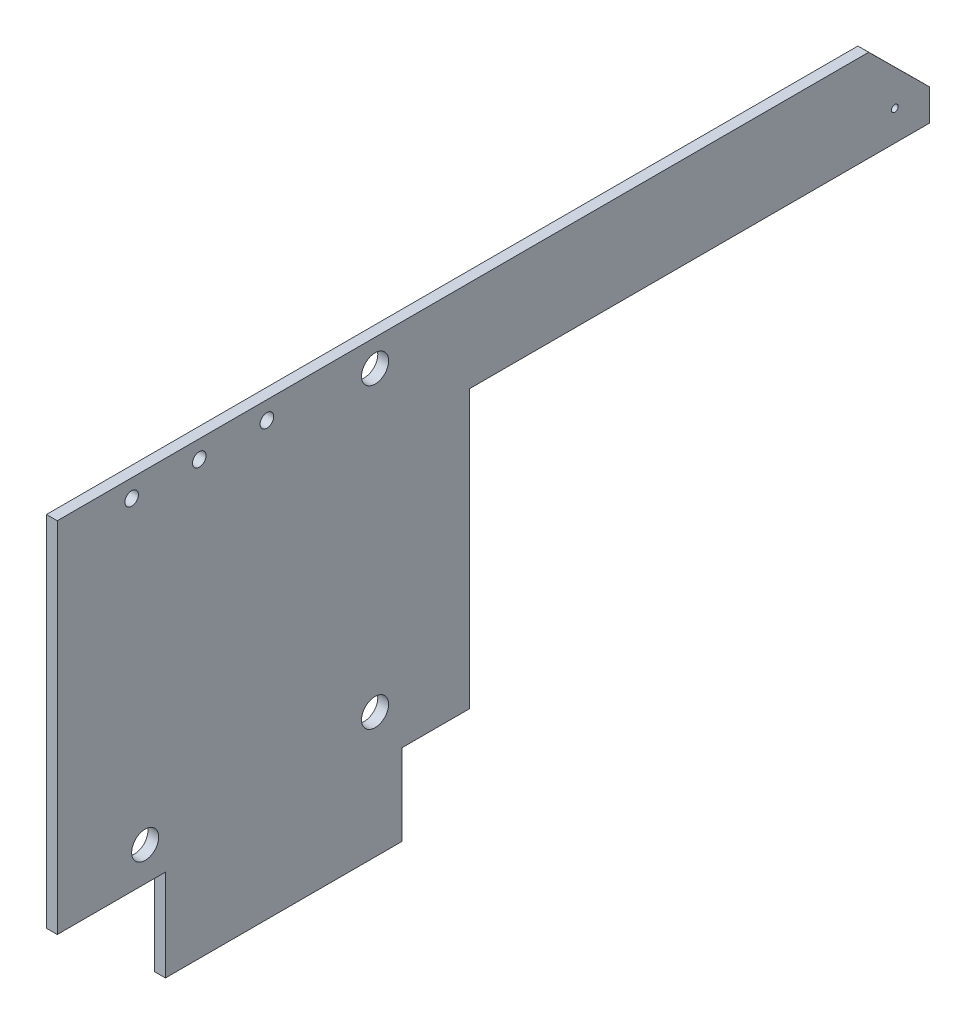
from build123d import *

# Parameters (mm, degrees)
SKETCH1_R           = 2
SKETCH1_R_2         = 1
SKETCH1_R_3         = 0.5
BOSS_EXTRUDE1_DEPTH = 1.6


with BuildPart() as part:
    # Sketch1 → Boss-Extrude1 (new body)
    with BuildSketch(Plane(origin=(0, 0, 0), x_dir=(0, 0, -1), z_dir=(1, 0, 0))):
        Polygon((0, 0), (0, 53), (120, 53), (129, 44.063430305), (129, 39.423430305), (61, 39.423430305), (61, -1.563926021), (51, -1.563926021), (51, -13.563926021), (16, -13.563926021), (16, 0), align=None)
        with Locations((13, 5)):
            Circle(SKETCH1_R, mode=Mode.SUBTRACT)
        with Locations((47, 5)):
            Circle(SKETCH1_R, mode=Mode.SUBTRACT)
        with Locations((47, 49)):
            Circle(SKETCH1_R, mode=Mode.SUBTRACT)
        with Locations((11, 50.35)):
            Circle(SKETCH1_R_2, mode=Mode.SUBTRACT)
        with Locations((21, 50.35)):
            Circle(SKETCH1_R_2, mode=Mode.SUBTRACT)
        with Locations((31, 50.35)):
            Circle(SKETCH1_R_2, mode=Mode.SUBTRACT)
        with Locations((123.861808856, 43.882900864)):
            Circle(SKETCH1_R_3, mode=Mode.SUBTRACT)
    extrude(amount=BOSS_EXTRUDE1_DEPTH)


solid = part.part
